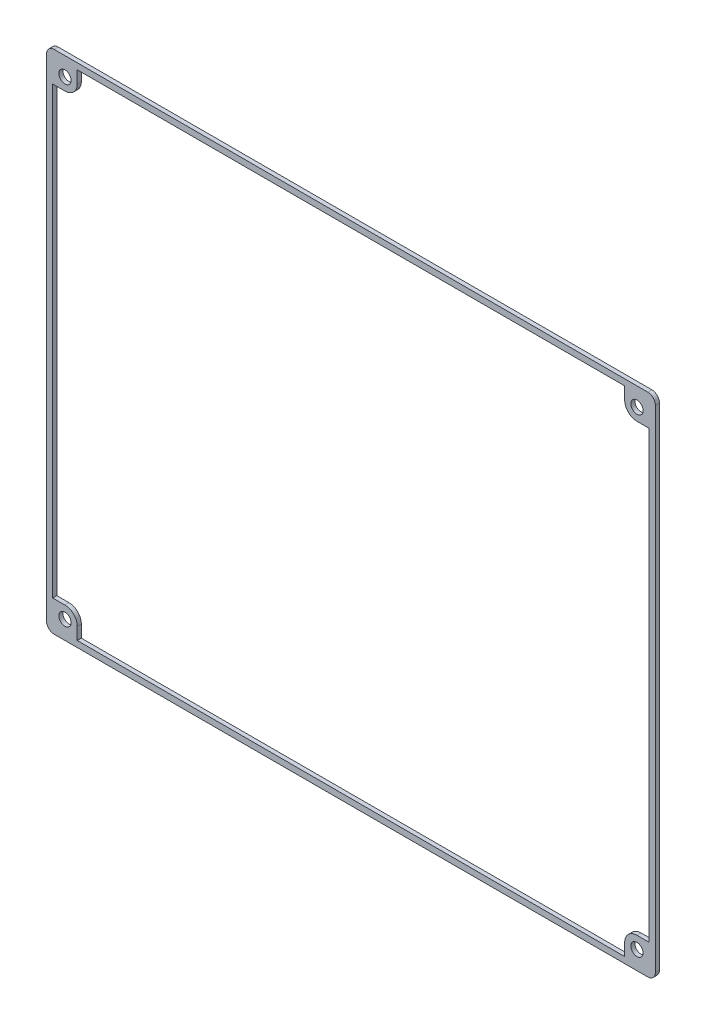
from build123d import *

# Parameters (mm, degrees)
SKETCH1_R           = 3
BOSS_EXTRUDE1_DEPTH = 2


with BuildPart() as part:
    # Sketch1 → Boss-Extrude1 (new body)
    with BuildSketch(Plane.XY):
        with BuildLine():
            Line((-3.7366, 240), (-3.7366, 0))
            ThreePointArc((-3.7366, 0), (-2.642175199, -2.642175199), (0, -3.7366))
            Line((0, -3.7366), (290, -3.7366))
            ThreePointArc((290, -3.7366), (292.642175199, -2.642175199), (293.7366, 0))
            Line((293.7366, 0), (293.7366, 240))
            ThreePointArc((293.7366, 240), (292.642175199, 242.642175199), (290, 243.7366))
            Line((290, 243.7366), (0, 243.7366))
            ThreePointArc((0, 243.7366), (-2.642175199, 242.642175199), (-3.7366, 240))
        make_face()
        with Locations((284.7366, 5.2634)):
            Circle(SKETCH1_R, mode=Mode.SUBTRACT)
        with Locations((284.7366, 234.7366)):
            Circle(SKETCH1_R, mode=Mode.SUBTRACT)
        with Locations((5.2634, 234.7366)):
            Circle(SKETCH1_R, mode=Mode.SUBTRACT)
        with Locations((5.2634, 5.2634)):
            Circle(SKETCH1_R, mode=Mode.SUBTRACT)
        with BuildLine():
            Line((278.7366, -0.7366), (11.2634, -0.7366))
            Line((11.2634, -0.7366), (11.2634, 5.2634))
            ThreePointArc((11.2634, 5.2634), (9.506040687, 9.506040687), (5.2634, 11.2634))
            Line((5.2634, 11.2634), (-0.7366, 11.2634))
            Line((-0.7366, 11.2634), (-0.7366, 228.7366))
            Line((-0.7366, 228.7366), (5.2634, 228.7366))
            ThreePointArc((5.2634, 228.7366), (9.506040687, 230.493959313), (11.2634, 234.7366))
            Line((11.2634, 234.7366), (11.2634, 240.7366))
            Line((11.2634, 240.7366), (278.7366, 240.7366))
            Line((278.7366, 240.7366), (278.7366, 234.7366))
            ThreePointArc((278.7366, 234.7366), (280.493959313, 230.493959313), (284.7366, 228.7366))
            Line((284.7366, 228.7366), (290.7366, 228.7366))
            Line((290.7366, 228.7366), (290.7366, 11.2634))
            Line((290.7366, 11.2634), (284.7366, 11.2634))
            ThreePointArc((284.7366, 11.2634), (280.493959313, 9.506040687), (278.7366, 5.2634))
            Line((278.7366, 5.2634), (278.7366, -0.7366))
        make_face(mode=Mode.SUBTRACT)
    extrude(amount=BOSS_EXTRUDE1_DEPTH)


solid = part.part
